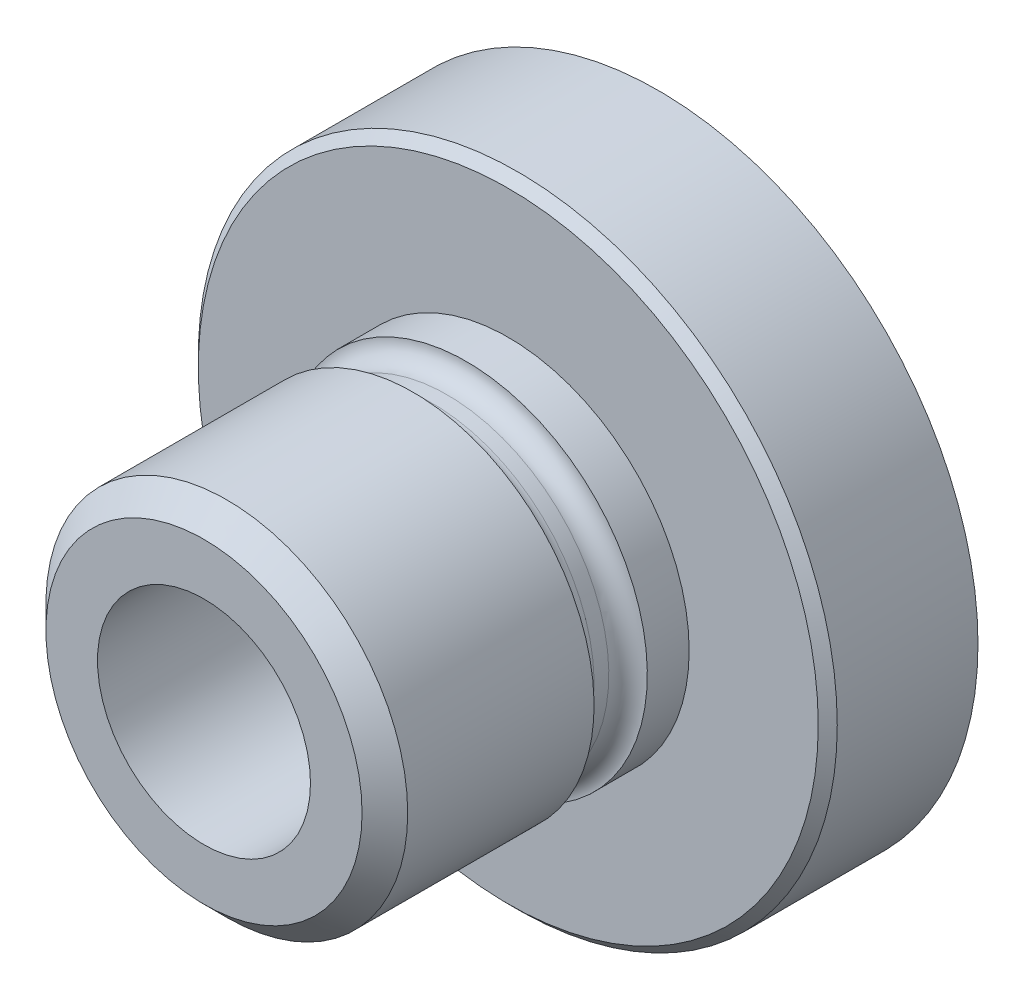
from build123d import *

# Parameters (mm, degrees)
SKETCH1_R      = 16.8
EXTRUDE1_DEPTH = 7.9
SKETCH2_R      = 9.5123
THREAD_DEPTH   = 16
CHAMFER1_SIZE  = 1.2
CHAMFER2_SIZE  = 0.5
RODHOLE_REACH  = 35.7
SKETCH9_R      = 5.6


with BuildPart() as part:
    # Sketch1 → Extrude1 (new body)
    with BuildSketch(Plane.XY):
        Circle(SKETCH1_R)
    extrude(amount=EXTRUDE1_DEPTH)

    # Sketch2 → THREAD (add)
    with BuildSketch(Plane.XY.offset(7.9)):
        Circle(SKETCH2_R)
    extrude(amount=THREAD_DEPTH)

    # Sketch3 → THREAD END (revolve, cut)
    with BuildSketch(Plane(origin=(0, 0, 0), x_dir=(0, 0, -1), z_dir=(1, 0, 0))):
        with BuildLine():
            Line((-11.8877, 8.5), (-11.1123, 8.5))
            ThreePointArc((-11.1123, 8.5), (-10.396495805, 8.796495805), (-10.1, 9.5123))
            Line((-10.1, 9.5123), (-12.9, 9.5123))
            ThreePointArc((-12.9, 9.5123), (-12.603504195, 8.796495805), (-11.8877, 8.5))
        make_face()
    revolve(axis=Axis((0, 0, 23.9), (0, 0, -1)), mode=Mode.SUBTRACT)

    # Chamfer1
    chamfer1_edges = [part.edges().sort_by_distance(p)[0] for p in [
        (-9.5123, 0, 23.9),
    ]]
    chamfer(chamfer1_edges, length=CHAMFER1_SIZE)

    # Chamfer2
    chamfer2_edges = [part.edges().sort_by_distance(p)[0] for p in [
        (-16.8, 0, 7.9),
    ]]
    chamfer(chamfer2_edges, length=CHAMFER2_SIZE)

    # Sketch9 → RodHole (cut, up to next)
    with BuildSketch(Plane.XY.offset(23.9), mode=Mode.PRIVATE) as rodhole_sk1:
        Circle(SKETCH9_R)
    rodhole_tool1 = extrude(rodhole_sk1.sketch, amount=-RODHOLE_REACH, mode=Mode.PRIVATE) & part.part
    add(rodhole_tool1.solids().sort_by_distance((0, 0, 23.9))[0], mode=Mode.SUBTRACT)


solid = part.part
